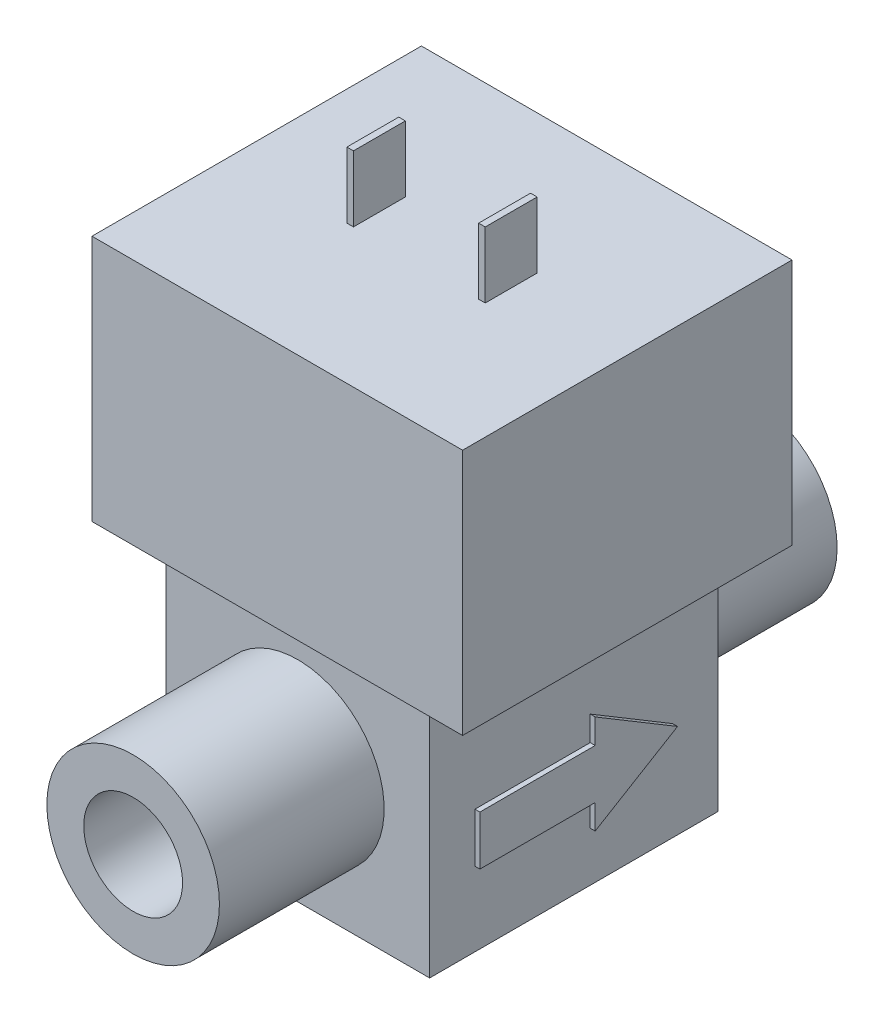
from build123d import *

# Parameters (mm, degrees)
SKETCH1_W             = 32
SKETCH1_H             = 35
BRASS_BODY_DEPTH      = 30
COIL_START            = 30
SKETCH2_W             = 45
SKETCH2_H             = 40
COIL_DEPTH            = 30
INLET_STUB_START      = 17.5
SKETCH3_R             = 10.4775
INLET_STUB_DEPTH      = 20
OUTLET_STUB_START     = -37.5
SKETCH4_R             = 10.4775
OUTLET_STUB_DEPTH     = 20
INLET_BORE_START      = 37.5
SKETCH5_R             = 6
INLET_BORE_DEPTH      = 12
OUTLET_BORE_START     = -25.5
SKETCH6_R             = 6
OUTLET_BORE_DEPTH     = 12
SPADE_TERMINALS_START = 60
SKETCH7_W             = 0.8
SKETCH7_H             = 6.3
SPADE_TERMINALS_DEPTH = 8
FLOW_ARROW_START      = 16
FLOW_ARROW_DEPTH      = 0.6


with BuildPart() as part:
    # Sketch1 → Brass_Body (new body)
    with BuildSketch(Plane(origin=(0, 0, 0), x_dir=(1, 0, 0), z_dir=(0, 1, 0))):
        Rectangle(SKETCH1_W, SKETCH1_H)
    extrude(amount=BRASS_BODY_DEPTH)

    # Sketch2 → Coil (add)
    with BuildSketch(Plane(origin=(0, 0, 0), x_dir=(1, 0, 0), z_dir=(0, 1, 0)).offset(COIL_START)):
        Rectangle(SKETCH2_W, SKETCH2_H)
    extrude(amount=COIL_DEPTH)

    # Sketch3 → Inlet_Stub (add)
    with BuildSketch(Plane.XY.offset(INLET_STUB_START)):
        with Locations(Location((0, 15, 0), (0, 0, 180))):
            Circle(SKETCH3_R)
    extrude(amount=INLET_STUB_DEPTH)

    # Sketch4 → Outlet_Stub (add)
    with BuildSketch(Plane.XY.offset(OUTLET_STUB_START)):
        with Locations(Location((0, 15, 0), (0, 0, 180))):
            Circle(SKETCH4_R)
    extrude(amount=OUTLET_STUB_DEPTH)

    # Sketch5 → Inlet_Bore (cut)
    with BuildSketch(Plane.XY.offset(INLET_BORE_START)):
        with Locations((0, 15)):
            Circle(SKETCH5_R)
    extrude(amount=-INLET_BORE_DEPTH, mode=Mode.SUBTRACT)

    # Sketch6 → Outlet_Bore (cut)
    with BuildSketch(Plane.XY.offset(OUTLET_BORE_START)):
        with Locations((0, 15)):
            Circle(SKETCH6_R)
    extrude(amount=-OUTLET_BORE_DEPTH, mode=Mode.SUBTRACT)

    # Sketch7 → Spade_Terminals (add)
    with BuildSketch(Plane(origin=(0, 0, 0), x_dir=(1, 0, 0), z_dir=(0, 1, 0)).offset(SPADE_TERMINALS_START)):
        with Locations((-8, 0)):
            Rectangle(SKETCH7_W, SKETCH7_H)
        with Locations((8, 0)):
            Rectangle(SKETCH7_W, SKETCH7_H)
    extrude(amount=SPADE_TERMINALS_DEPTH)

    # Sketch8 → Flow_Arrow (add)
    with BuildSketch(Plane(origin=(0, 0, 0), x_dir=(0, 0, -1), z_dir=(1, 0, 0)).offset(FLOW_ARROW_START)):
        Polygon((-12, 9), (2, 9), (2, 6), (12, 12), (2, 18), (2, 15), (-12, 15), align=None)
    extrude(amount=FLOW_ARROW_DEPTH)


solid = part.part
